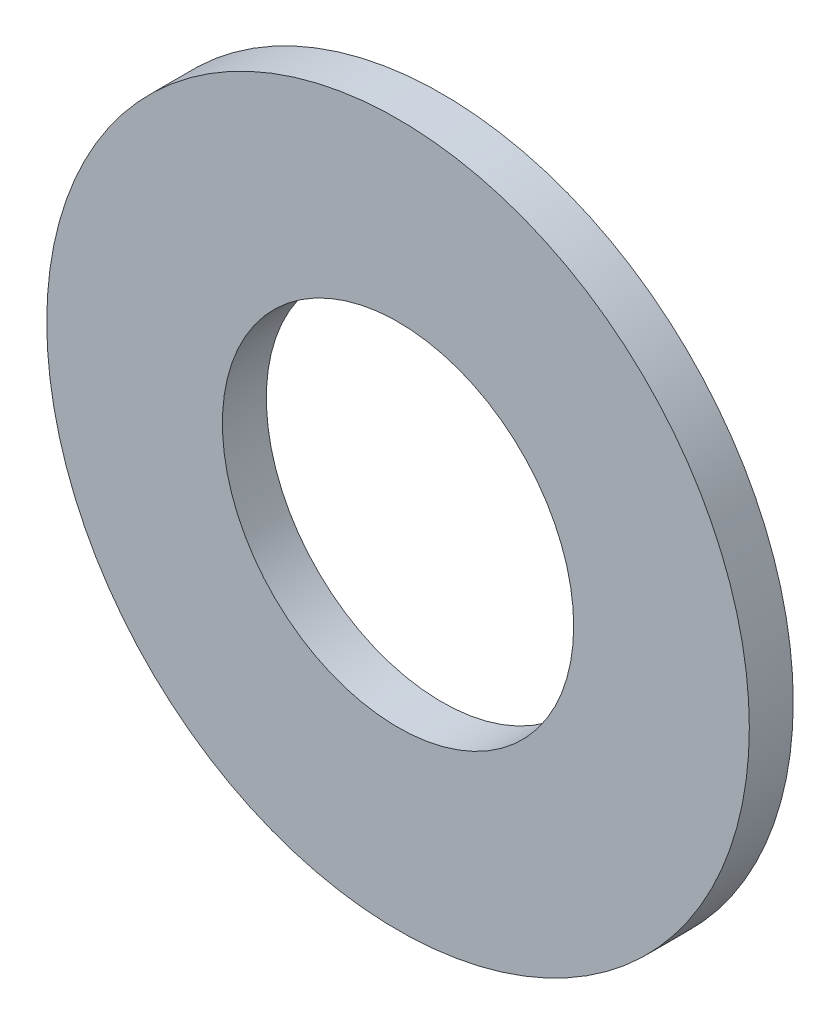
from build123d import *

# Parameters (mm, degrees)
SKETCH_1_R      = 4
SKETCH_1_R_2    = 2
EXTRUDE_1_DEPTH = 0.5


with BuildPart() as part:
    # 草图1 → 凸台-拉伸1 (new body)
    with BuildSketch(Plane.XY):
        with Locations((-14.200760757, -9.727168501)):
            Circle(SKETCH_1_R)
        with Locations((-14.200760757, -9.727168501)):
            Circle(SKETCH_1_R_2, mode=Mode.SUBTRACT)
    extrude(amount=EXTRUDE_1_DEPTH)


solid = part.part
